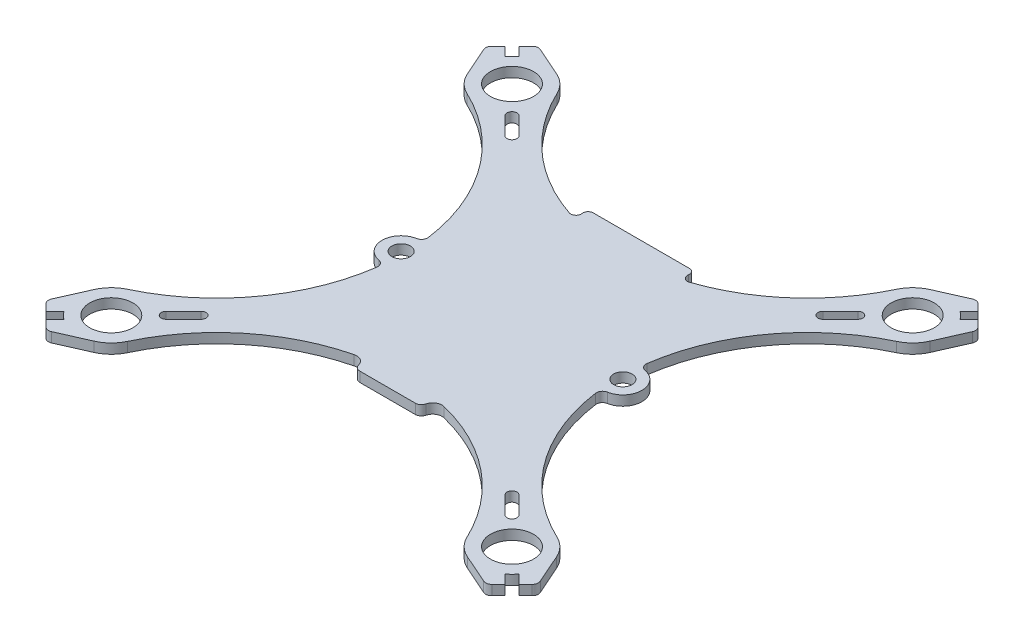
from build123d import *

# Parameters (mm, degrees)
EXTRUDE_1_DEPTH     = 1.6
SKETCH_2_R          = 3.5
SKETCH_2_R_2        = 1.5
CUT_EXTRUDE_2_DEPTH = 120.775748848


with BuildPart() as part:
    # 草图1 → 凸台-拉伸1 (new body)
    with BuildSketch(Plane(origin=(0, 0, 0), x_dir=(1, 0, 0), z_dir=(0, 1, 0))):
        with BuildLine():
            Line((47.950455462, 53.500678068), (63.550455462, 53.500678068))
            ThreePointArc((63.550455462, 53.500678068), (64.200939835, 53.197825288), (64.387892442, 52.505078257))
            ThreePointArc((64.387892442, 52.505078257), (64.672019835, 51.714227719), (65.496953127, 51.554046536))
            ThreePointArc((65.496953127, 51.554046536), (76.012452894, 57.657876981), (83.307978073, 67.384530764))
            ThreePointArc((83.307978073, 67.384530764), (84.439034072, 68.966777391), (86.050077403, 70.056424786))
            Line((86.050077403, 70.056424786), (90.83225012, 72.174467215))
            ThreePointArc((90.83225012, 72.174467215), (91.420402092, 72.243211116), (91.944318718, 71.967240399))
            Line((91.944318718, 71.967240399), (93.014982831, 70.896576286))
            Line((93.014982831, 70.896576286), (91.559408573, 69.441002029))
            ThreePointArc((91.559408573, 69.441002029), (92.166454693, 68.916677299), (92.690779423, 68.309631179))
            Line((92.690779423, 68.309631179), (94.146353681, 69.765205436))
            Line((94.146353681, 69.765205436), (95.217017793, 68.694541323))
            ThreePointArc((95.217017793, 68.694541323), (95.49298851, 68.170624698), (95.424244609, 67.582472725))
            Line((95.424244609, 67.582472725), (93.306202181, 62.800300009))
            ThreePointArc((93.306202181, 62.800300009), (92.216554786, 61.189256677), (90.634308158, 60.058200679))
            ThreePointArc((90.634308158, 60.058200679), (79.105768954, 50.532503354), (73.491163469, 36.671683358))
            ThreePointArc((73.491163469, 36.671683358), (73.672060349, 35.948096267), (74.303399444, 35.550965423))
            ThreePointArc((74.303399444, 35.550965423), (76.850455462, 32.500678068), (74.303399444, 29.450390712))
            ThreePointArc((74.303399444, 29.450390712), (73.672060349, 29.053259868), (73.491163469, 28.329672777))
            ThreePointArc((73.491163469, 28.329672777), (79.105768724, 14.468853095), (90.634307454, 4.94315579))
            ThreePointArc((90.634307454, 4.94315579), (92.216554514, 3.812099737), (93.306202181, 2.201056127))
            Line((93.306202181, 2.201056127), (95.424244609, -2.58111659))
            ThreePointArc((95.424244609, -2.58111659), (95.49298851, -3.169268563), (95.217017793, -3.693185188))
            Line((95.217017793, -3.693185188), (94.146353681, -4.763849301))
            Line((94.146353681, -4.763849301), (92.690779423, -3.308275044))
            ThreePointArc((92.690779423, -3.308275044), (92.166454693, -3.915321163), (91.559408573, -4.439645893))
            Line((91.559408573, -4.439645893), (93.014982831, -5.895220151))
            Line((93.014982831, -5.895220151), (91.944318718, -6.965884264))
            ThreePointArc((91.944318718, -6.965884264), (91.420402092, -7.24185498), (90.83225012, -7.173111079))
            Line((90.83225012, -7.173111079), (86.050077403, -5.055068651))
            ThreePointArc((86.050077403, -5.055068651), (84.439034072, -3.965421256), (83.307978073, -2.383174628))
            ThreePointArc((83.307978073, -2.383174628), (75.037180063, 8.17430315), (63.037239962, 14.163282556))
            ThreePointArc((63.037239962, 14.163282556), (61.901454693, 13.989537546), (61.221822682, 13.063094977))
            ThreePointArc((61.221822682, 13.063094977), (60.867876271, 12.514045024), (60.250455462, 12.300678068))
            Line((60.250455462, 12.300678068), (51.250455462, 12.300678068))
            ThreePointArc((51.250455462, 12.300678068), (50.633034654, 12.514045024), (50.279088243, 13.063094977))
            ThreePointArc((50.279088243, 13.063094977), (49.599456231, 13.989537546), (48.463670963, 14.163282556))
            ThreePointArc((48.463670963, 14.163282556), (36.463730861, 8.17430315), (28.192932851, -2.383174628))
            ThreePointArc((28.192932851, -2.383174628), (27.061876853, -3.965421256), (25.450833521, -5.055068651))
            Line((25.450833521, -5.055068651), (20.668660805, -7.173111079))
            ThreePointArc((20.668660805, -7.173111079), (20.080508832, -7.24185498), (19.556592206, -6.965884264))
            Line((19.556592206, -6.965884264), (18.485928094, -5.895220151))
            Line((18.485928094, -5.895220151), (19.941502351, -4.439645893))
            ThreePointArc((19.941502351, -4.439645893), (19.334456231, -3.915321163), (18.810131501, -3.308275044))
            Line((18.810131501, -3.308275044), (17.354557244, -4.763849301))
            Line((17.354557244, -4.763849301), (16.283893131, -3.693185188))
            ThreePointArc((16.283893131, -3.693185188), (16.007922414, -3.169268563), (16.076666315, -2.58111659))
            Line((16.076666315, -2.58111659), (18.194708744, 2.201056127))
            ThreePointArc((18.194708744, 2.201056127), (19.28435641, 3.812099737), (20.86660347, 4.94315579))
            ThreePointArc((20.86660347, 4.94315579), (32.395142201, 14.468853095), (38.009747455, 28.329672777))
            ThreePointArc((38.009747455, 28.329672777), (37.828850575, 29.053259868), (37.19751148, 29.450390712))
            ThreePointArc((37.19751148, 29.450390712), (34.650455462, 32.500678068), (37.19751148, 35.550965423))
            ThreePointArc((37.19751148, 35.550965423), (37.828850575, 35.948096267), (38.009747455, 36.671683358))
            ThreePointArc((38.009747455, 36.671683358), (32.39514197, 50.532503354), (20.866602766, 60.058200679))
            ThreePointArc((20.866602766, 60.058200679), (19.284356139, 61.189256677), (18.194708744, 62.800300009))
            Line((18.194708744, 62.800300009), (16.076666315, 67.582472725))
            ThreePointArc((16.076666315, 67.582472725), (16.007922414, 68.170624698), (16.283893131, 68.694541323))
            Line((16.283893131, 68.694541323), (17.354557244, 69.765205436))
            Line((17.354557244, 69.765205436), (18.810131501, 68.309631179))
            ThreePointArc((18.810131501, 68.309631179), (19.334456231, 68.916677299), (19.941502351, 69.441002029))
            Line((19.941502351, 69.441002029), (18.485928094, 70.896576286))
            Line((18.485928094, 70.896576286), (19.556592206, 71.967240399))
            ThreePointArc((19.556592206, 71.967240399), (20.080508832, 72.243211116), (20.668660805, 72.174467215))
            Line((20.668660805, 72.174467215), (25.450833521, 70.056424786))
            ThreePointArc((25.450833521, 70.056424786), (27.061876853, 68.966777391), (28.192932851, 67.384530764))
            ThreePointArc((28.192932851, 67.384530764), (35.488458031, 57.657876981), (46.003957797, 51.554046536))
            ThreePointArc((46.003957797, 51.554046536), (46.82889109, 51.714227719), (47.113018482, 52.505078257))
            ThreePointArc((47.113018482, 52.505078257), (47.299971089, 53.197825288), (47.950455462, 53.500678068))
        make_face()
    extrude(amount=EXTRUDE_1_DEPTH)

    # 草图2 → 切除-拉伸2 (cut, through all)
    with BuildSketch(Plane(origin=(0, 0, 0), x_dir=(1, 0, 0), z_dir=(0, 1, 0))):
        with Locations(Location((88.277367397, -0.026233867, 0), (0, 0, 270))):
            Circle(SKETCH_2_R)
        with Locations(Location((88.277367397, 65.027590002, 0), (0, 0, 270))):
            Circle(SKETCH_2_R)
        with Locations(Location((23.223543528, -0.026233867, 0), (0, 0, 270))):
            Circle(SKETCH_2_R)
        with Locations(Location((23.223543528, 65.027590002, 0), (0, 0, 270))):
            Circle(SKETCH_2_R)
        with Locations(Location((37.750455462, 32.500678068, 0), (0, 0, 270))):
            Circle(SKETCH_2_R_2)
        with Locations(Location((73.750455462, 32.500678068, 0), (0, 0, 270))):
            Circle(SKETCH_2_R_2)
        with BuildLine():
            Line((84.3882801, 4.994224279), (81.559852975, 7.822651404))
            ThreePointArc((81.559852975, 7.822651404), (80.428482126, 7.822651404), (80.428482126, 6.691280554))
            Line((80.428482126, 6.691280554), (83.25690925, 3.86285343))
            ThreePointArc((83.25690925, 3.86285343), (84.3882801, 3.86285343), (84.3882801, 4.994224279))
        make_face()
        with BuildLine():
            Line((27.112630824, 60.007131856), (29.941057949, 57.178704731))
            ThreePointArc((29.941057949, 57.178704731), (31.072428799, 57.178704731), (31.072428799, 58.310075581))
            Line((31.072428799, 58.310075581), (28.244001674, 61.138502706))
            ThreePointArc((28.244001674, 61.138502706), (27.112630824, 61.138502706), (27.112630824, 60.007131856))
        make_face()
        with BuildLine():
            Line((27.112630824, 4.994224279), (29.941057949, 7.822651404))
            ThreePointArc((29.941057949, 7.822651404), (31.072428799, 7.822651404), (31.072428799, 6.691280554))
            Line((31.072428799, 6.691280554), (28.244001674, 3.86285343))
            ThreePointArc((28.244001674, 3.86285343), (27.112630824, 3.86285343), (27.112630824, 4.994224279))
        make_face()
        with BuildLine():
            Line((84.3882801, 60.007131856), (81.559852975, 57.178704731))
            ThreePointArc((81.559852975, 57.178704731), (80.428482126, 57.178704731), (80.428482126, 58.310075581))
            Line((80.428482126, 58.310075581), (83.25690925, 61.138502706))
            ThreePointArc((83.25690925, 61.138502706), (84.3882801, 61.138502706), (84.3882801, 60.007131856))
        make_face()
    extrude(amount=CUT_EXTRUDE_2_DEPTH, mode=Mode.SUBTRACT)


solid = part.part
